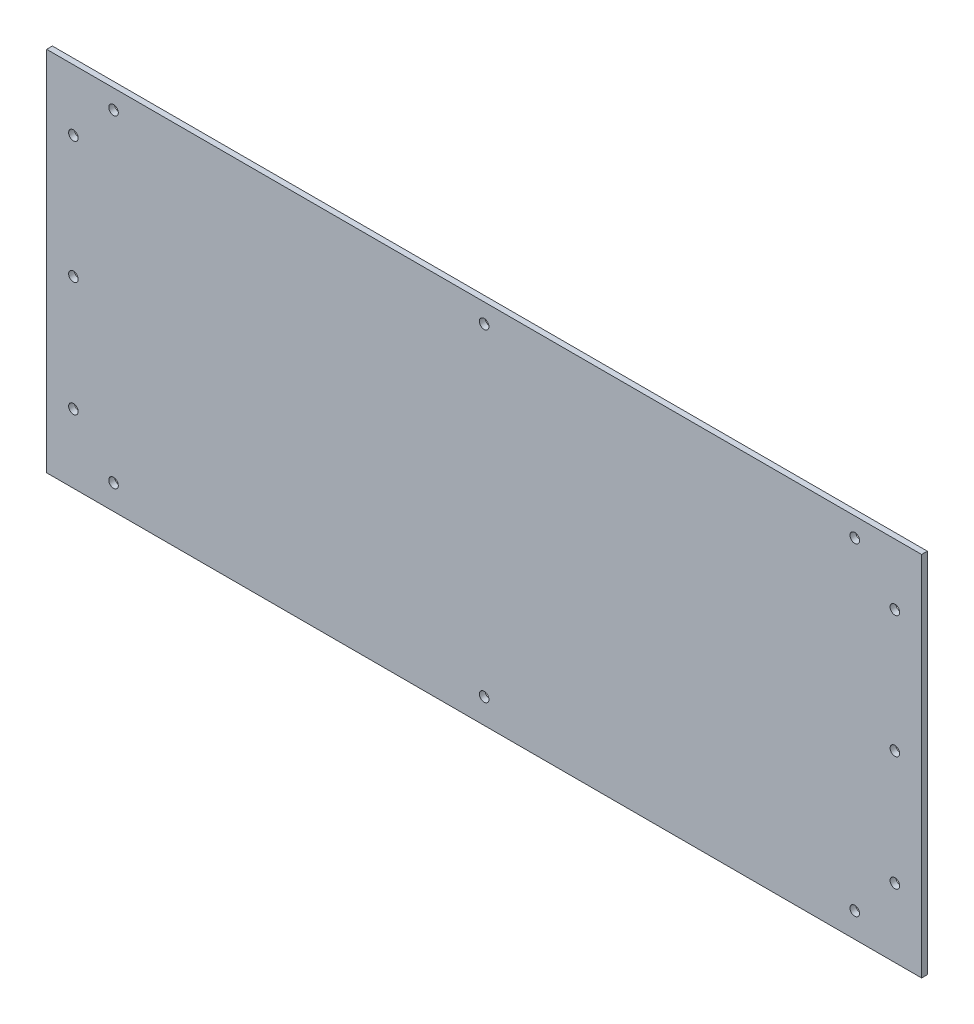
from build123d import *

# Parameters (mm, degrees)
SKETCH1_W           = 458
SKETCH1_H           = 192
BOSS_EXTRUDE1_DEPTH = 3
SKETCH2_R           = 2.5
CUT_EXTRUDE1_DEPTH  = 249.326398113


with BuildPart() as part:
    # Sketch1 → Boss-Extrude1 (new body)
    with BuildSketch(Plane.XY):
        Rectangle(SKETCH1_W, SKETCH1_H)
    extrude(amount=BOSS_EXTRUDE1_DEPTH)

    # Sketch2 → Cut-Extrude1 (cut, through all)
    with BuildSketch(Plane.XY.offset(3)):
        with Locations((-194, 86)):
            Circle(SKETCH2_R)
        with Locations((-194, -83.004592541)):
            Circle(SKETCH2_R)
        with Locations((194, -83.004592541)):
            Circle(SKETCH2_R)
        with Locations((194, 86)):
            Circle(SKETCH2_R)
        with Locations((-215, 0)):
            Circle(SKETCH2_R)
        with Locations((-215, -60)):
            Circle(SKETCH2_R)
        with Locations((-215, 64)):
            Circle(SKETCH2_R)
        with Locations((215, 0)):
            Circle(SKETCH2_R)
        with Locations((215, -60)):
            Circle(SKETCH2_R)
        with Locations((215, 64)):
            Circle(SKETCH2_R)
        with Locations((0, 86)):
            Circle(SKETCH2_R)
        with Locations((0, -83)):
            Circle(SKETCH2_R)
    extrude(amount=-CUT_EXTRUDE1_DEPTH, mode=Mode.SUBTRACT)


solid = part.part
